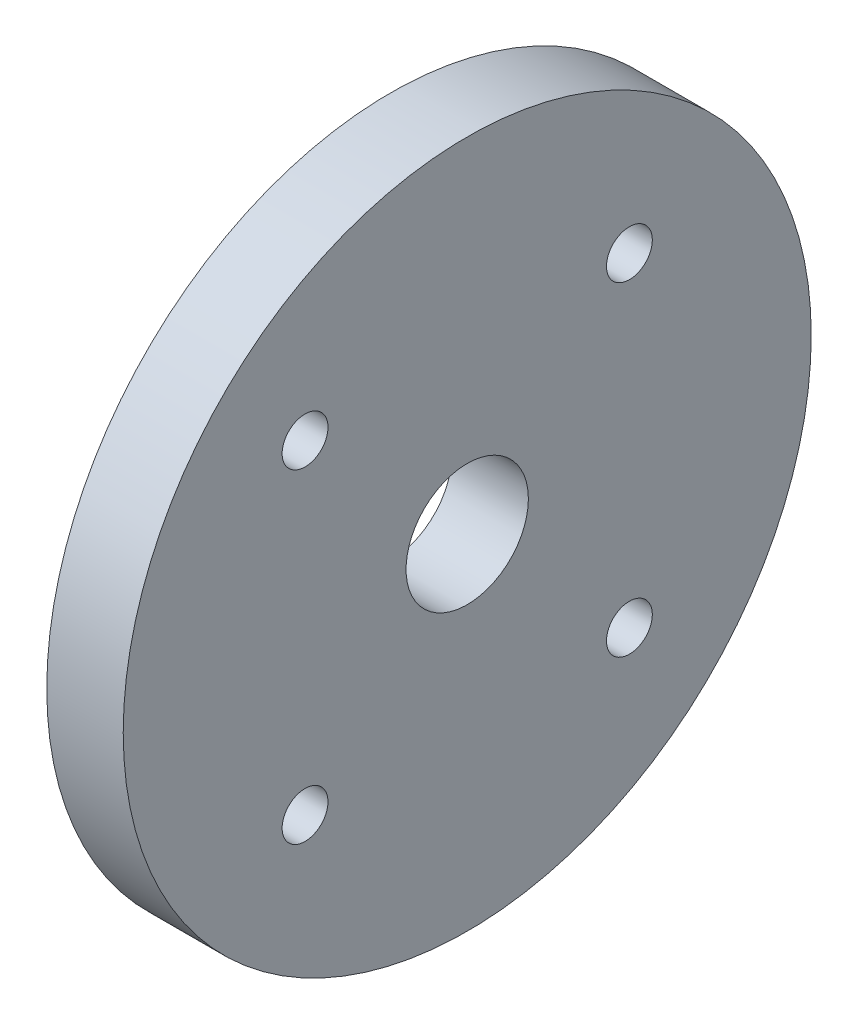
from build123d import *

# Parameters (mm, degrees)
SKETCH1_R           = 22.5
SKETCH1_R_2         = 4
SKETCH1_R_3         = 1.5
BOSS_EXTRUDE1_DEPTH = 5


with BuildPart() as part:
    # Sketch1 → Boss-Extrude1 (new body)
    with BuildSketch(Plane(origin=(0, 0, 0), x_dir=(0, 0, -1), z_dir=(1, 0, 0))):
        Circle(SKETCH1_R)
        Circle(SKETCH1_R_2, mode=Mode.SUBTRACT)
        with Locations((-10.606601718, 10.606601718)):
            Circle(SKETCH1_R_3, mode=Mode.SUBTRACT)
        with Locations(Location((-10.606601718, -10.606601718, 0), (0, 0, 180))):
            Circle(SKETCH1_R_3, mode=Mode.SUBTRACT)
        with Locations((10.606601718, -10.606601718)):
            Circle(SKETCH1_R_3, mode=Mode.SUBTRACT)
        with Locations((10.606601718, 10.606601718)):
            Circle(SKETCH1_R_3, mode=Mode.SUBTRACT)
    extrude(amount=BOSS_EXTRUDE1_DEPTH)


solid = part.part
